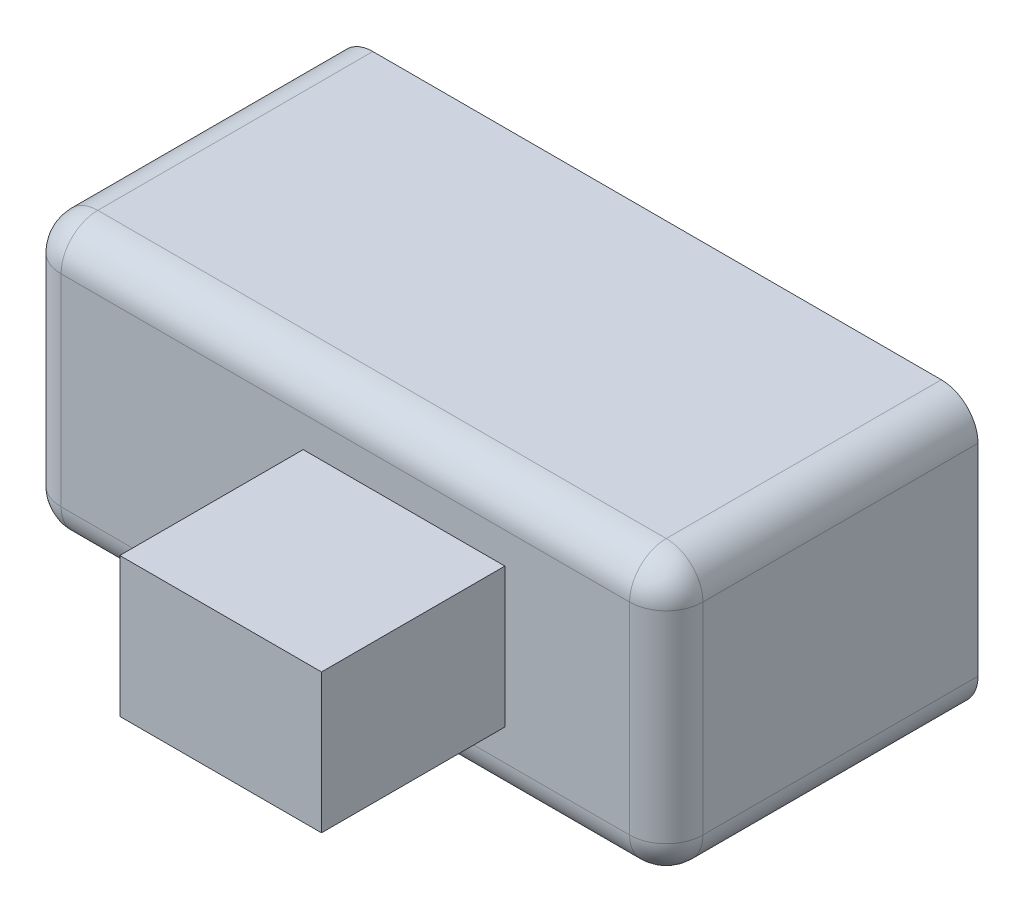
from build123d import *

# Parameters (mm, degrees)
SKETCH1_W           = 17.5
SKETCH1_H           = 7.5
BOSS_EXTRUDE1_DEPTH = 8.5
SKETCH2_W           = 5.5
SKETCH2_H           = 3.8
BOSS_EXTRUDE2_DEPTH = 5
FILLET1_R           = 1
FILLET2_R           = 1


with BuildPart() as part:
    # Sketch1 → Boss-Extrude1 (new body)
    with BuildSketch(Plane.XY):
        Rectangle(SKETCH1_W, SKETCH1_H)
    extrude(amount=BOSS_EXTRUDE1_DEPTH)

    # Sketch2 → Boss-Extrude2 (add)
    with BuildSketch(Plane.XY.offset(8.5)):
        with Locations((1.6, 0)):
            Rectangle(SKETCH2_W, SKETCH2_H)
    extrude(amount=BOSS_EXTRUDE2_DEPTH)

    # Fillet1
    fillet1_edges = [part.edges().sort_by_distance(p)[0] for p in [
        (8.75, -3.75, 4.25),
        (-8.75, -3.75, 4.25),
        (-8.75, 3.75, 4.25),
        (8.75, 3.75, 4.25),
    ]]
    fillet(fillet1_edges, radius=FILLET1_R)

    # Fillet2
    fillet2_edges = [part.edges().sort_by_distance(p)[0] for p in [
        (8.75, 0, 8.5),
        (0, -3.75, 8.5),
        (0, 3.75, 8.5),
        (-8.75, 0, 8.5),
        (-8.457106781, 3.457106781, 8.5),
        (-8.457106781, -3.457106781, 8.5),
        (8.457106781, 3.457106781, 8.5),
        (8.457106781, -3.457106781, 8.5),
    ]]
    fillet(fillet2_edges, radius=FILLET2_R)


solid = part.part
